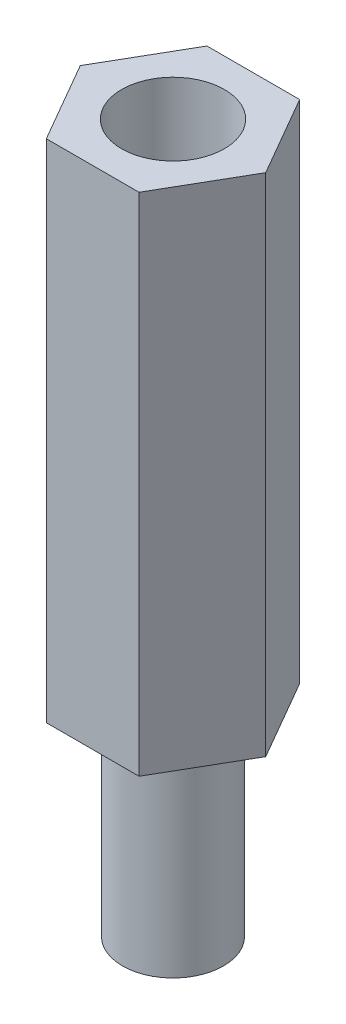
from build123d import *

# Parameters (mm, degrees)
SKETCH_1_R           = 1.5
EXTRUDE_1_DEPTH      = 6
EXTRUDE_2_DEPTH      = 15
HOLE_WIZARD_41_D     = 3.048
HOLE_WIZARD_41_DEPTH = 6
HOLE_WIZARD_41_TIP   = 0.915711583


with BuildPart() as part:
    # Эскиз1 → Бобышка-Вытянуть1 (new body)
    with BuildSketch(Plane(origin=(0, 0, 0), x_dir=(1, 0, 0), z_dir=(0, 1, 0))):
        with Locations(Location((0, 0, 0), (0, 0, 270))):
            Circle(SKETCH_1_R)
    extrude(amount=EXTRUDE_1_DEPTH)

    # Эскиз2 → Бобышка-Вытянуть2 (add)
    with BuildSketch(Plane(origin=(0, 6, 0), x_dir=(1, 0, 0), z_dir=(0, 1, 0))):
        Polygon((2.75, 0), (1.375, 2.38156986), (-1.375, 2.38156986), (-2.75, 0), (-1.375, -2.38156986), (1.375, -2.38156986), align=None)
    extrude(amount=EXTRUDE_2_DEPTH)

    # Сверло под метчик  спиральное #41
    with Locations(Plane(origin=(0, 21, 0), x_dir=(1, 0, 0), z_dir=(0, 1, 0))):
        with Locations((0, 0)):
            Hole(HOLE_WIZARD_41_D / 2, depth=HOLE_WIZARD_41_DEPTH)
            with Locations((0, 0, -(HOLE_WIZARD_41_DEPTH + HOLE_WIZARD_41_TIP / 2))):  # 118° drill point
                Cone(0, HOLE_WIZARD_41_D / 2, HOLE_WIZARD_41_TIP, mode=Mode.SUBTRACT)


solid = part.part
